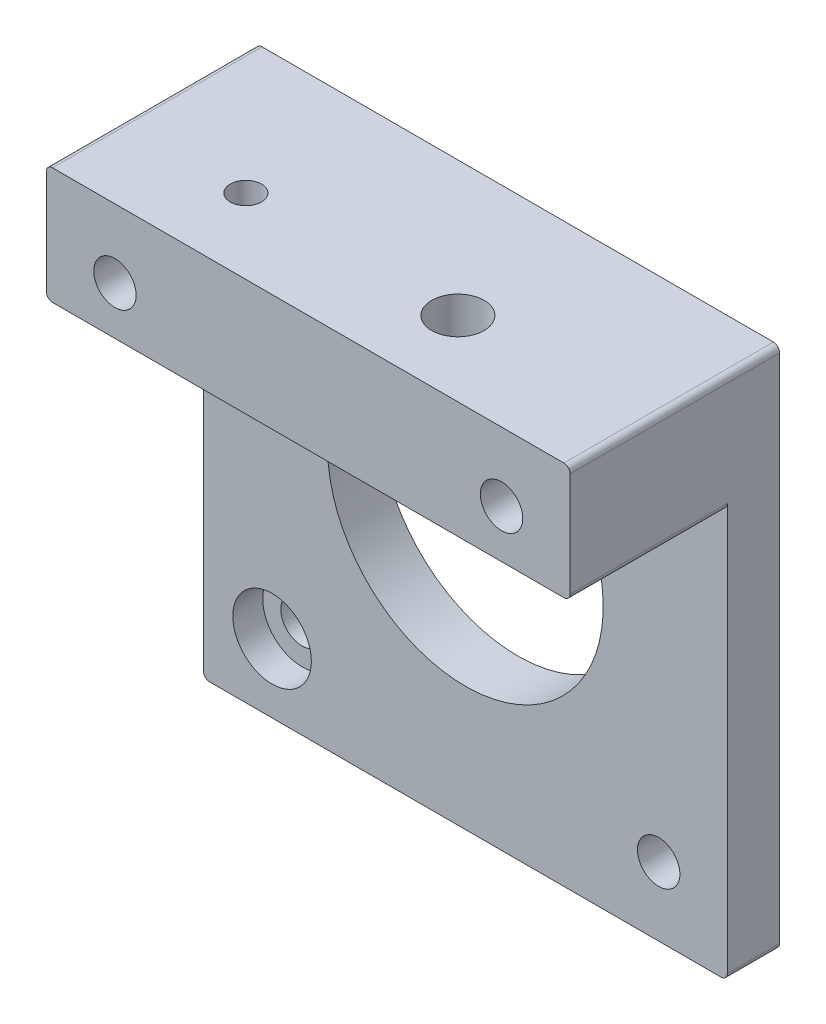
from build123d import *

# Parameters (mm, degrees)
SKETCH1_W            = 42
SKETCH1_H            = 42
BOSS_EXTRUDE1_DEPTH  = 16.8
SKETCH2_W            = 42
SKETCH2_H            = 32.65
CUT_EXTRUDE1_DEPTH   = 12.6
CUT_EXTRUDE2_REACH   = 36.121
SKETCH3_R            = 11.05
M3_CLEARANCE_HOLE1_D = 3.4
SKETCH6_R            = 3.15
CUT_EXTRUDE3_DEPTH   = 2.4
M5_TAPPED_HOLE1_D    = 4.2
M3_TAPPED_HOLE1_D    = 2.5
FILLET1_R            = 0.5


with BuildPart() as part:
    # Sketch1 → Boss-Extrude1 (new body)
    with BuildSketch(Plane.XY):
        Rectangle(SKETCH1_W, SKETCH1_H)
    extrude(amount=BOSS_EXTRUDE1_DEPTH)

    # Sketch2 → Cut-Extrude1 (cut)
    with BuildSketch(Plane.XY.offset(16.8)):
        with Locations((0, -4.675)):
            Rectangle(SKETCH2_W, SKETCH2_H)
    extrude(amount=-CUT_EXTRUDE1_DEPTH, mode=Mode.SUBTRACT)

    # Sketch3 → Cut-Extrude2 (cut, up to next)
    with BuildSketch(Plane(origin=(0, 0, 0), x_dir=(-1, 0, 0), z_dir=(0, 0, -1)), mode=Mode.PRIVATE) as cut_extrude2_sk1:
        Circle(SKETCH3_R)
    cut_extrude2_tool1 = extrude(cut_extrude2_sk1.sketch, amount=-CUT_EXTRUDE2_REACH, mode=Mode.PRIVATE) & part.part
    add(cut_extrude2_tool1.solids().sort_by_distance((0, 0, 0))[0], mode=Mode.SUBTRACT)

    # M3 Clearance Hole1 (through all)
    with Locations(Plane.XY.offset(16.8)):
        with Locations((15.5, 15.5), (-15.5, 15.5), (-15.5, -15.5), (15.5, -15.5)):
            Hole(M3_CLEARANCE_HOLE1_D / 2)

    # Sketch6 → Cut-Extrude3 (cut)
    with BuildSketch(Plane.XY.offset(4.2)):
        with Locations((-15.5, -15.5)):
            Circle(SKETCH6_R)
    extrude(amount=-CUT_EXTRUDE3_DEPTH, mode=Mode.SUBTRACT)

    # M5 Tapped Hole1 (through all)
    with Locations(Plane(origin=(0, 21, 0), x_dir=(1, 0, 0), z_dir=(0, 1, 0))):
        with Locations((6, -10.8)):
            Hole(M5_TAPPED_HOLE1_D / 2)

    # M3 Tapped Hole1 (through all)
    with Locations(Plane(origin=(0, 21, 0), x_dir=(1, 0, 0), z_dir=(0, 1, 0))):
        with Locations((-11, -10.8)):
            Hole(M3_TAPPED_HOLE1_D / 2)

    # Fillet1
    fillet1_edges = [part.edges().sort_by_distance(p)[0] for p in [
        (21, -21, 2.1),
        (-21, -21, 2.1),
        (-21, 11.65, 10.5),
        (21, 11.65, 10.5),
        (-21, 21, 8.4),
        (21, 21, 8.4),
    ]]
    fillet(fillet1_edges, radius=FILLET1_R)


solid = part.part
